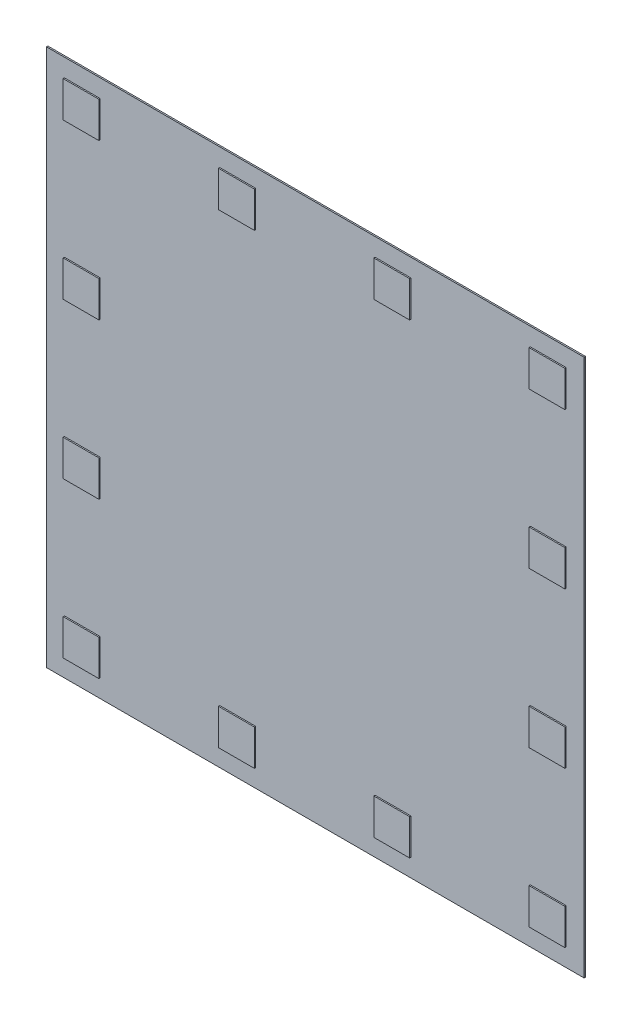
from build123d import *

# Parameters (mm, degrees)
SKETCH_1_W      = 300
SKETCH_1_H      = 300
EXTRUDE_1_DEPTH = 0.1
SKETCH_2_W      = 20
SKETCH_2_H      = 20
EXTRUDE_2_DEPTH = 0.7
SKETCH_3_W      = 300
SKETCH_3_H      = 300
EXTRUDE_3_DEPTH = 0.7


with BuildPart() as part:
    # 스케치1 → 보스-돌출1 (new body)
    with BuildSketch(Plane.XY):
        Rectangle(SKETCH_1_W, SKETCH_1_H)
    extrude(amount=EXTRUDE_1_DEPTH)

    # 스케치2 → 보스-돌출2 (add)
    with BuildSketch(Plane.XY.offset(0.1)):
        with Locations((-43.333333333, 130)):
            Rectangle(SKETCH_2_W, SKETCH_2_H)
        with Locations((-130, 130)):
            Rectangle(SKETCH_2_W, SKETCH_2_H)
        with Locations((43.333333333, 130)):
            Rectangle(SKETCH_2_W, SKETCH_2_H)
        with Locations((130, 130)):
            Rectangle(SKETCH_2_W, SKETCH_2_H)
        with Locations((-130, 43.333333333)):
            Rectangle(SKETCH_2_W, SKETCH_2_H)
        with Locations((-130, -43.333333333)):
            Rectangle(SKETCH_2_W, SKETCH_2_H)
        with Locations((-130, -130)):
            Rectangle(SKETCH_2_W, SKETCH_2_H)
        with Locations((130, 43.333333333)):
            Rectangle(SKETCH_2_W, SKETCH_2_H)
        with Locations((130, -43.333333333)):
            Rectangle(SKETCH_2_W, SKETCH_2_H)
        with Locations((-43.333333333, -130)):
            Rectangle(SKETCH_2_W, SKETCH_2_H)
        with Locations((43.333333333, -130)):
            Rectangle(SKETCH_2_W, SKETCH_2_H)
        with Locations((130, -130)):
            Rectangle(SKETCH_2_W, SKETCH_2_H)
    extrude(amount=EXTRUDE_2_DEPTH)


with BuildPart() as body_2:
    # 스케치3 → 보스-돌출3 (new body)
    with BuildSketch(Plane(origin=(0, 0, 0), x_dir=(-1, 0, 0), z_dir=(0, 0, -1))):
        Rectangle(SKETCH_3_W, SKETCH_3_H)
    extrude(amount=EXTRUDE_3_DEPTH)


solid = Compound([part.part, body_2.part])
